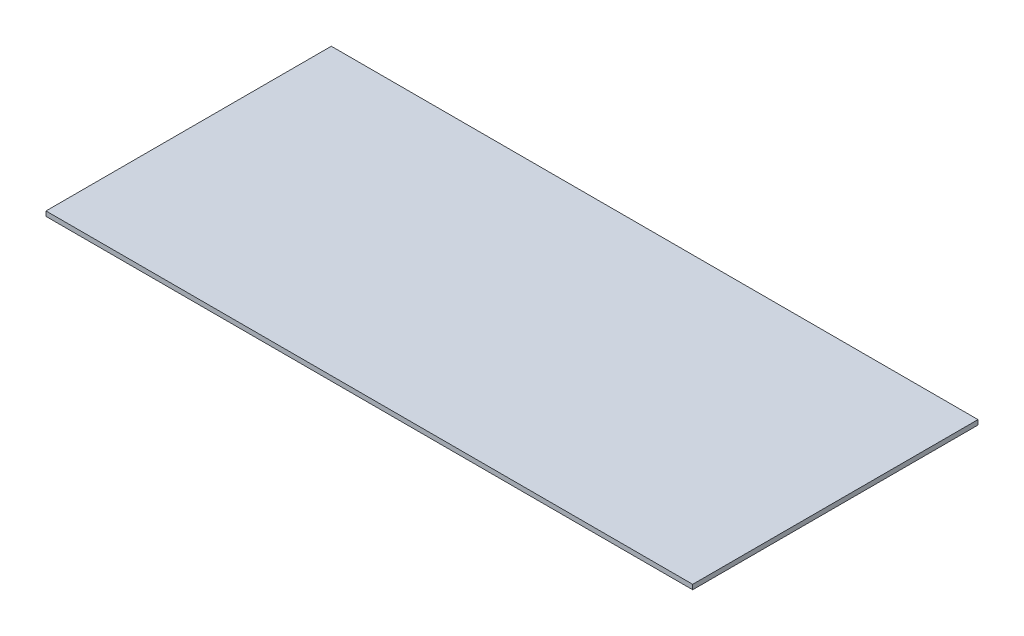
from build123d import *

# Parameters (mm, degrees)
SKIZZE1_W                       = 680
SKIZZE1_H                       = 300
AUFSATZ_LINEAR_AUSTRAGEN1_DEPTH = 5


with BuildPart() as part:
    # Skizze1 → Aufsatz-Linear austragen1 (new body)
    with BuildSketch(Plane(origin=(0, 0, 0), x_dir=(1, 0, 0), z_dir=(0, 1, 0))):
        Rectangle(SKIZZE1_W, SKIZZE1_H)
    extrude(amount=AUFSATZ_LINEAR_AUSTRAGEN1_DEPTH)


solid = part.part
